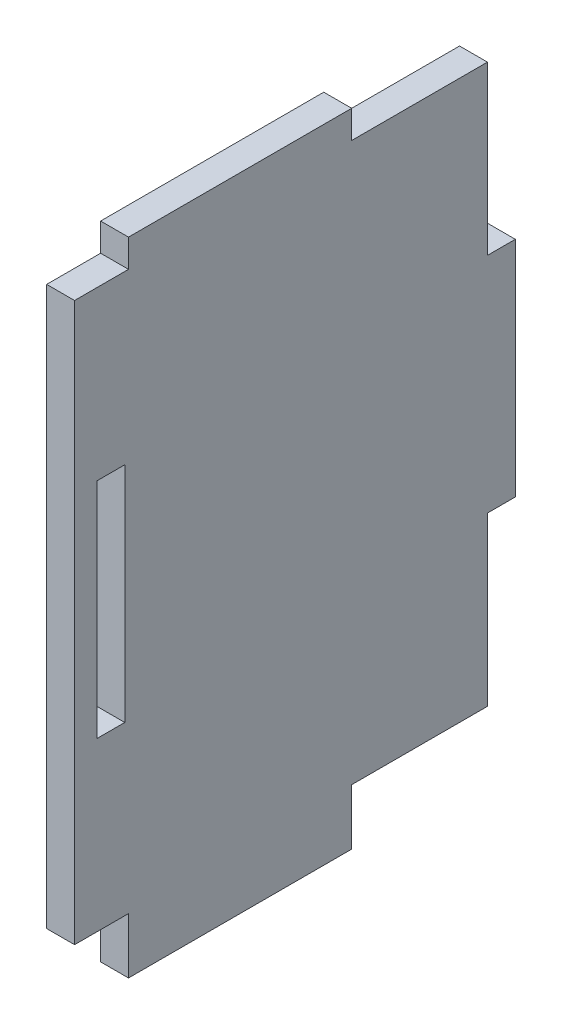
from build123d import *

# Parameters (mm, degrees)
SKETCH1_W           = 2.5
SKETCH1_H           = 20
BOSS_EXTRUDE2_DEPTH = 1.25


with BuildPart() as part:
    # Sketch1 (on Right Plane) → Boss-Extrude2 (new, symmetric)
    with BuildSketch(Plane(origin=(0, 0, 0), x_dir=(0, 0, -1), z_dir=(1, 0, 0))):
        Polygon((4.833333333, 5), (0, 5), (0, 55), (4.833333333, 55), (4.833333333, 57.5), (24.833333333, 57.5), (24.833333333, 55), (37, 55), (37, 40), (39.5, 40), (39.5, 20), (37, 20), (37, 5), (24.833333333, 5), (24.833333333, 0), (4.833333333, 0), align=None)
        with Locations((3.25, 30)):
            Rectangle(SKETCH1_W, SKETCH1_H, mode=Mode.SUBTRACT)
    extrude(amount=BOSS_EXTRUDE2_DEPTH, both=True)


solid = part.part
